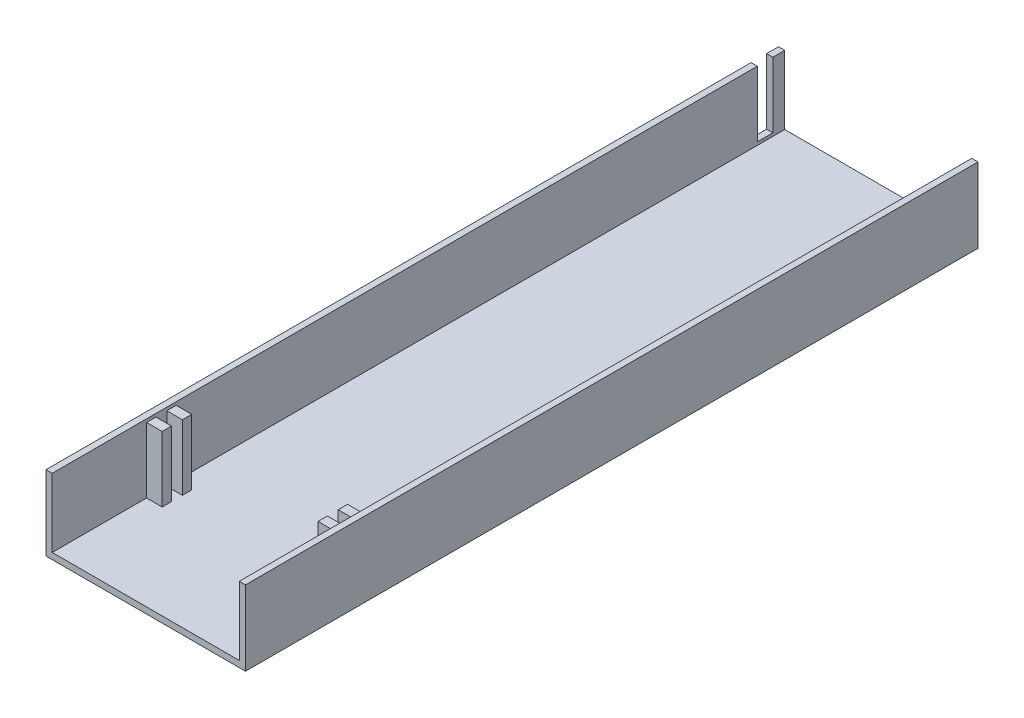
from build123d import *

# Parameters (mm, degrees)
BOSS_EXTRUDE1_DEPTH      = 35
BOSS_EXTRUDE1_DEPTH_BACK = 45
BOSS_EXTRUDE3_DEPTH      = 155
SKETCH5_W                = 5
SKETCH5_H                = 3
BOSS_EXTRUDE5_DEPTH      = 21
CUT_EXTRUDE1_DEPTH       = 10


with BuildPart() as part:
    # Sketch1 → Boss-Extrude1 (new, two sides: drawn at the far end of the back side and taken through both)
    with BuildSketch(Plane.XY.offset(-BOSS_EXTRUDE1_DEPTH_BACK)):
        Polygon((-30, 12), (-30, 10), (-30, -10), (30, -10), (30, 10), (30, 12), (32, 12), (32, -12), (-32, -12), (-32, 12), align=None)
    extrude(amount=BOSS_EXTRUDE1_DEPTH + BOSS_EXTRUDE1_DEPTH_BACK)

    # Sketch3 → Boss-Extrude3 (add)
    with BuildSketch(Plane(origin=(0, 0, -45), x_dir=(-1, 0, 0), z_dir=(0, 0, -1))):
        Polygon((-30, -10), (-30, 12), (-32, 12), (-32, -12), (32, -12), (32, 12), (30, 12), (30, -10), align=None)
    extrude(amount=BOSS_EXTRUDE3_DEPTH)

    # Sketch5 → Boss-Extrude5 (add)
    with BuildSketch(Plane(origin=(0, -10, 0), x_dir=(1, 0, 0), z_dir=(0, 1, 0))):
        with Locations((-27.5, -3.25)):
            Rectangle(SKETCH5_W, SKETCH5_H)
        with Locations((-27.5, 3.25)):
            Rectangle(SKETCH5_W, SKETCH5_H)
        with Locations((27.5, -3.25)):
            Rectangle(SKETCH5_W, SKETCH5_H)
        with Locations((27.5, 3.25)):
            Rectangle(SKETCH5_W, SKETCH5_H)
    extrude(amount=BOSS_EXTRUDE5_DEPTH)

    # Sketch6 → Cut-Extrude1 (cut)
    with BuildSketch(Plane.ZY.offset(32)):
        Polygon((-196.2, 9), (-196.2, -9), (-191.2, -9), (-191.2, 9), (-191.2, 12), (-196.2, 12), align=None)
    extrude(amount=-CUT_EXTRUDE1_DEPTH, mode=Mode.SUBTRACT)


solid = part.part
